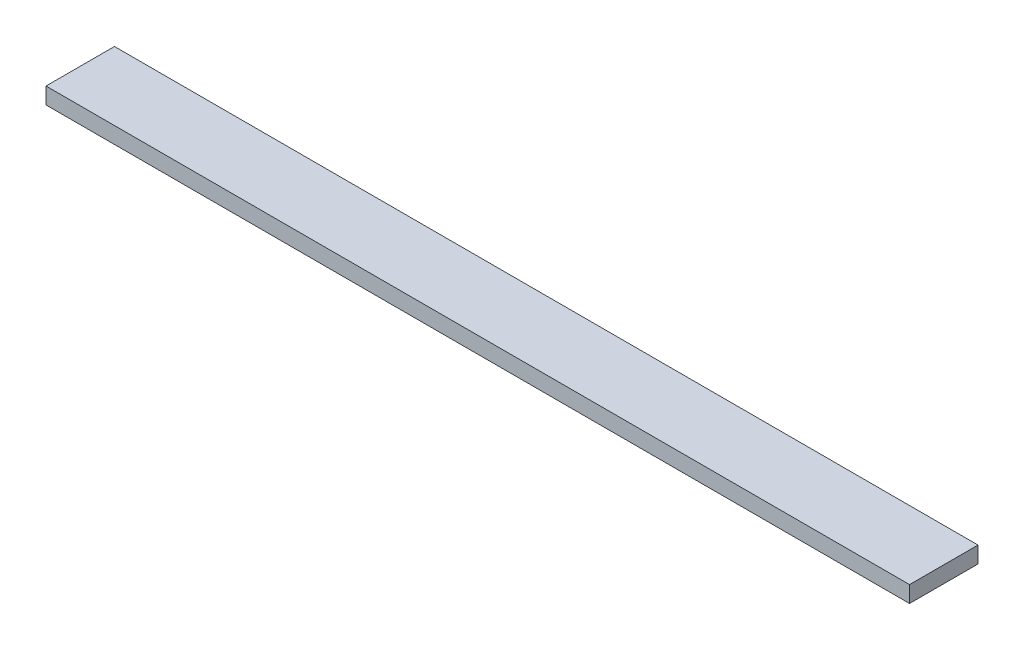
from build123d import *

# Parameters (mm, degrees)
SKETCH1_W           = 961.136
SKETCH1_H           = 76.2
BOSS_EXTRUDE1_DEPTH = 18.25625


with BuildPart() as part:
    # Sketch1 → Boss-Extrude1 (new body)
    with BuildSketch(Plane(origin=(0, 0, 0), x_dir=(1, 0, 0), z_dir=(0, 1, 0))):
        Rectangle(SKETCH1_W, SKETCH1_H)
    extrude(amount=BOSS_EXTRUDE1_DEPTH)


solid = part.part
